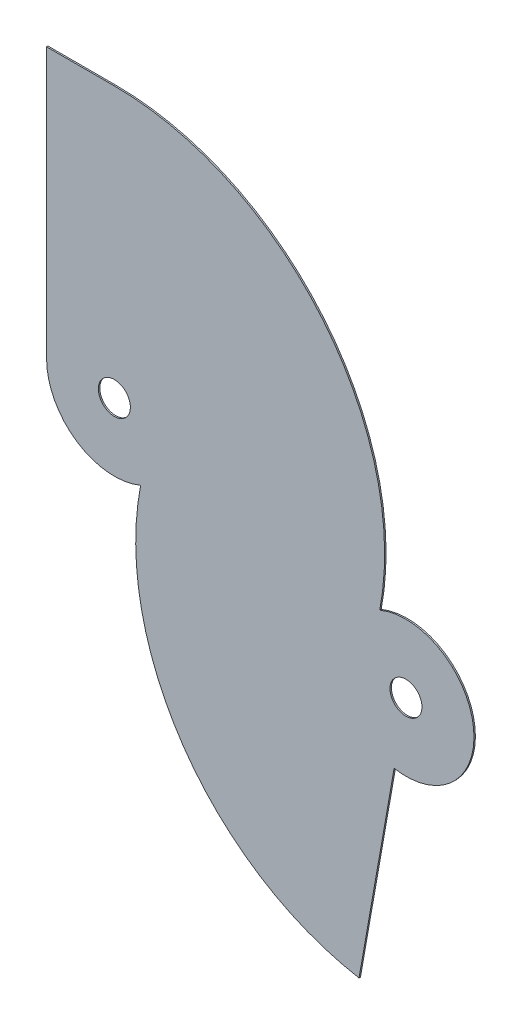
from build123d import *

# Parameters (mm, degrees)
SKETCH1_W           = 431.8
SKETCH1_H           = 609.6
BOSS_EXTRUDE1_DEPTH = 1.27
SKETCH2_R           = 14.2875
CUT_EXTRUDE1_DEPTH  = 1.27
SKETCH3_OUTSIDE_W   = 583.208
SKETCH3_OUTSIDE_H   = 761.008
CUT_EXTRUDE2_DEPTH  = 2.54


with BuildPart() as part:
    # Sketch1 → Boss-Extrude1 (new body)
    with BuildSketch(Plane.XY):
        with Locations((215.9, 304.8)):
            Rectangle(SKETCH1_W, SKETCH1_H)
    extrude(amount=BOSS_EXTRUDE1_DEPTH)

    # Sketch2 → Cut-Extrude1 (cut)
    with BuildSketch(Plane(origin=(0, 0, 0), x_dir=(-1, 0, 0), z_dir=(0, 0, -1))):
        with Locations((-82.55, 355.6)):
            Circle(SKETCH2_R)
        with Locations((-342.9, 254)):
            Circle(SKETCH2_R)
    extrude(amount=-CUT_EXTRUDE1_DEPTH, mode=Mode.SUBTRACT)

    # Sketch3 outside → Cut-Extrude2 (cut)
    with BuildSketch(Plane(origin=(0, 0, 0), x_dir=(-1, 0, 0), z_dir=(0, 0, -1))):
        with Locations((-215.9, 304.8)):
            Rectangle(SKETCH3_OUTSIDE_W, SKETCH3_OUTSIDE_H)
        with BuildLine():
            Line((-332.352291022, 194.180969832), (-300.998694729, 16.365889198))
            ThreePointArc((-300.998694729, 16.365889198), (-144.106457916, 117.227131251), (-105.987607355, 299.806202759))
            ThreePointArc((-105.987607355, 299.806202759), (-49.054456035, 305.198434711), (-22.033314292, 355.6))
            Line((-22.033314292, 355.6), (-22.033314292, 596.899879542))
            Line((-22.033314292, 596.899879542), (-82.308891716, 596.899879542))
            ThreePointArc((-82.308891716, 596.899879542), (-268.503650886, 509.375582335), (-319.513573185, 310.059304096))
            ThreePointArc((-319.513573185, 310.059304096), (-403.272414901, 260.688950139), (-332.352291022, 194.180969832))
        make_face(mode=Mode.SUBTRACT)
    extrude(amount=-CUT_EXTRUDE2_DEPTH, mode=Mode.SUBTRACT)


solid = part.part
